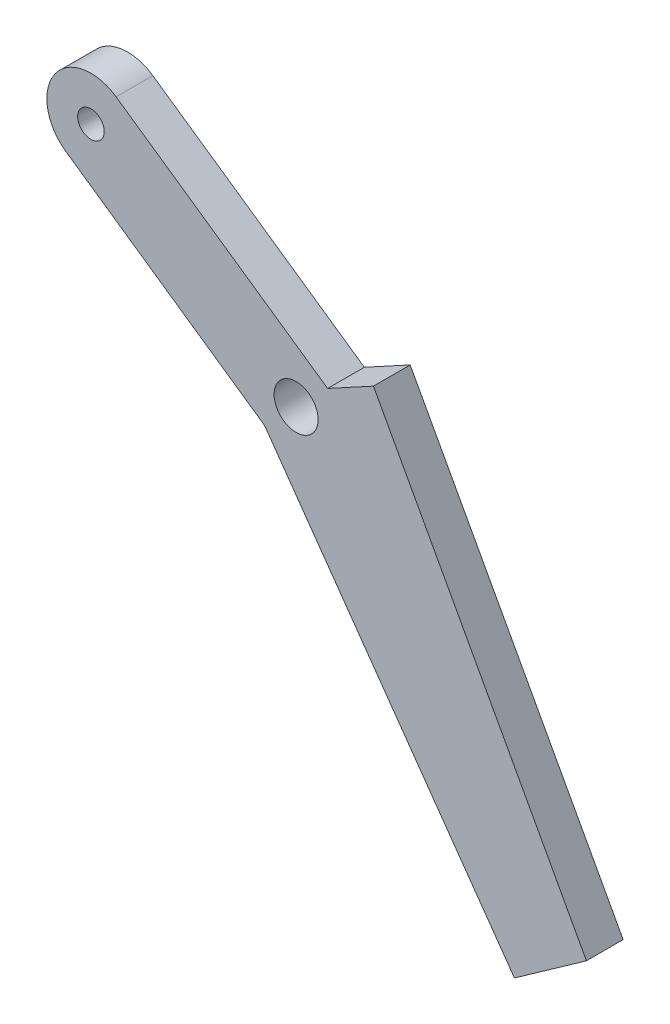
from build123d import *

# Parameters (mm, degrees)
CROQUIS1_R              = 1.5
CROQUIS1_R_2            = 0.901496021
SALIENTE_EXTRUIR1_DEPTH = 2.5


with BuildPart() as part:
    # Croquis1 → Saliente-Extruir1 (new body)
    with BuildSketch(Plane.XY):
        with BuildLine():
            Line((190.999396497, -54.10039675), (176.598168196, -44.106909056))
            ThreePointArc((176.598168196, -44.106909056), (172.423130969, -44.861272465), (173.177494378, -49.036309692))
            Line((173.177494378, -49.036309692), (186.709536348, -58.4266403))
            Line((186.709536348, -58.4266403), (203.71520856, -82.496290836))
            Line((203.71520856, -82.496290836), (208.615544817, -79.034108783))
            Line((208.615544817, -79.034108783), (194.118553112, -52.402476506))
            Line((194.118553112, -52.402476506), (190.999396497, -54.10039675))
        make_face()
        with Locations((188.854466423, -56.263518525)):
            Circle(CROQUIS1_R, mode=Mode.SUBTRACT)
        with Locations((174.887831287, -46.571609374)):
            Circle(CROQUIS1_R_2, mode=Mode.SUBTRACT)
    extrude(amount=SALIENTE_EXTRUIR1_DEPTH)


solid = part.part
